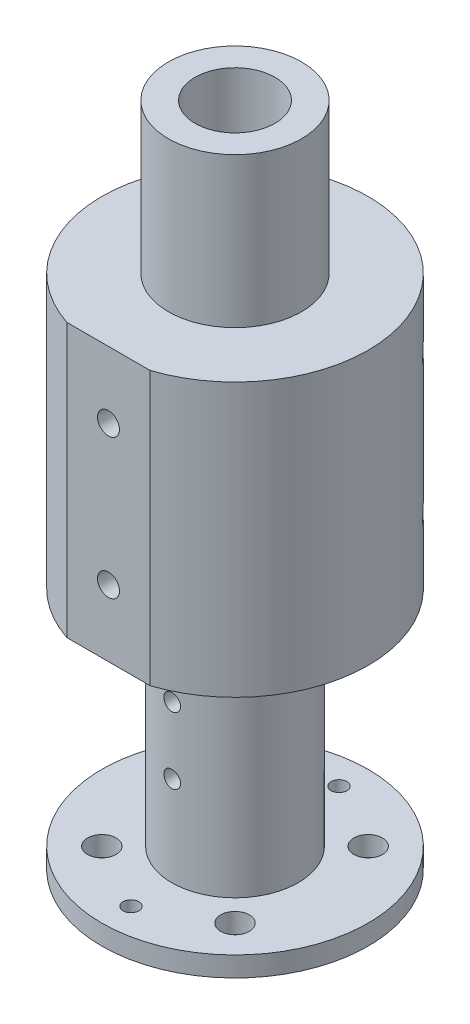
from build123d import *

# Parameters (mm, degrees)
CUT_EXTRUDE2_REACH              = 84.5
M4_TAPPED_HOLE1_D               = 3.3
M4_TAPPED_HOLE1_DEPTH           = 10.1
M4_TAPPED_HOLE1_TIP             = 0.991420021
M4_TAPPED_HOLE1_ON_FACE_2_D     = 3.3
M4_TAPPED_HOLE1_ON_FACE_2_DEPTH = 10.1
M4_TAPPED_HOLE1_ON_FACE_2_TIP   = 0.991420021
M4_TAPPED_HOLE1_ON_FACE_3_D     = 3.3
M4_TAPPED_HOLE1_ON_FACE_3_DEPTH = 10.1
M4_TAPPED_HOLE1_ON_FACE_3_TIP   = 0.991420021
M4_TAPPED_HOLE1_ON_FACE_4_D     = 3.3
M4_TAPPED_HOLE1_ON_FACE_4_DEPTH = 10.1
M4_TAPPED_HOLE1_ON_FACE_4_TIP   = 0.991420021
CUT_EXTRUDE1_START              = -66.9
CUT_EXTRUDE1_DEPTH              = 66.9
M3_TAPPED_HOLE1_REACH           = 92.788
M3_TAPPED_HOLE1_BORE_R          = 1.25
F_2_4MM_DOWEL_HOLE1_D           = 2.38125
F_2_4MM_DOWEL_HOLE1_DEPTH       = 3
M4_CLEARANCE_HOLE2_D            = 4.3
M4_CLEARANCE_HOLE2_DEPTH        = 3


with BuildPart() as part:
    # Sketch1 → Revolve1 (revolve)
    with BuildSketch(Plane.XY, mode=Mode.PRIVATE) as revolve1_sk:
        Polygon((5.5, 66.9), (5.5, 0), (20, 0), (20, 3), (9.5, 3), (9.5, 36.5), (20, 36.5), (20, 77.5), (10, 77.5), (10, 100), (6, 100), (6, 66.9), align=None)
    revolve(revolve1_sk.sketch.rotate(Axis((0, 0, 0), (0, 1, 0)), 90), axis=Axis((0, 0, 0), (0, 1, 0)))

    # Sketch6 → Cut-Extrude2 (cut, up to next)
    with BuildSketch(Plane(origin=(0, 77.5, 0), x_dir=(1, 0, 0), z_dir=(0, 1, 0)), mode=Mode.PRIVATE) as cut_extrude2_sk1:
        with BuildLine():
            Line((-6.244997998, -19), (6.244997998, -19))
            ThreePointArc((6.244997998, -19), (0, -20), (-6.244997998, -19))
        make_face()
    cut_extrude2_tool1 = extrude(cut_extrude2_sk1.sketch, amount=-CUT_EXTRUDE2_REACH, mode=Mode.PRIVATE) & part.part
    add(cut_extrude2_tool1.solids().sort_by_distance((0, 77.5, 19.40087))[0], mode=Mode.SUBTRACT)

    # M4 Tapped Hole1
    with Locations(Plane(origin=(14.142135624, 67.5, -14.142135624), x_dir=(0.707106781187, 0, 0.707106781187), z_dir=(0.707106781187, 0, -0.707106781187))):
        with Locations((0, 0)):
            Hole(M4_TAPPED_HOLE1_D / 2, depth=M4_TAPPED_HOLE1_DEPTH)
            with Locations((0, 0, -(M4_TAPPED_HOLE1_DEPTH + M4_TAPPED_HOLE1_TIP / 2))):  # 118° drill point
                Cone(0, M4_TAPPED_HOLE1_D / 2, M4_TAPPED_HOLE1_TIP, mode=Mode.SUBTRACT)

    # M4 Tapped Hole1 on face 2
    with Locations(Plane(origin=(14.142135624, 46.5, -14.142135624), x_dir=(-0.707106781187, 0, -0.707106781187), z_dir=(0.707106781187, 0, -0.707106781187))):
        with Locations((0, 0)):
            Hole(M4_TAPPED_HOLE1_ON_FACE_2_D / 2, depth=M4_TAPPED_HOLE1_ON_FACE_2_DEPTH)
            with Locations((0, 0, -(M4_TAPPED_HOLE1_ON_FACE_2_DEPTH + M4_TAPPED_HOLE1_ON_FACE_2_TIP / 2))):  # 118° drill point
                Cone(0, M4_TAPPED_HOLE1_ON_FACE_2_D / 2, M4_TAPPED_HOLE1_ON_FACE_2_TIP, mode=Mode.SUBTRACT)

    # M4 Tapped Hole1 on face 3
    with Locations(Plane(origin=(-14.142135624, 46.5, -14.142135624), x_dir=(-0.707106781187, 0, 0.707106781187), z_dir=(-0.707106781187, 0, -0.707106781187))):
        with Locations((0, 0), (0, 21)):
            Hole(M4_TAPPED_HOLE1_ON_FACE_3_D / 2, depth=M4_TAPPED_HOLE1_ON_FACE_3_DEPTH)
            with Locations((0, 0, -(M4_TAPPED_HOLE1_ON_FACE_3_DEPTH + M4_TAPPED_HOLE1_ON_FACE_3_TIP / 2))):  # 118° drill point
                Cone(0, M4_TAPPED_HOLE1_ON_FACE_3_D / 2, M4_TAPPED_HOLE1_ON_FACE_3_TIP, mode=Mode.SUBTRACT)

    # M4 Tapped Hole1 on face 4
    with Locations(Plane(origin=(0, 67.5, 19), x_dir=(1, 0, 0), z_dir=(0, 0, 1))):
        with Locations((0, 0), (0, -21)):
            Hole(M4_TAPPED_HOLE1_ON_FACE_4_D / 2, depth=M4_TAPPED_HOLE1_ON_FACE_4_DEPTH)
            with Locations((0, 0, -(M4_TAPPED_HOLE1_ON_FACE_4_DEPTH + M4_TAPPED_HOLE1_ON_FACE_4_TIP / 2))):  # 118° drill point
                Cone(0, M4_TAPPED_HOLE1_ON_FACE_4_D / 2, M4_TAPPED_HOLE1_ON_FACE_4_TIP, mode=Mode.SUBTRACT)

    # Sketch3 → Cut-Extrude1 (cut)
    with BuildSketch(Plane.XZ.offset(CUT_EXTRUDE1_START)):
        with BuildLine():
            ThreePointArc((4.818762467, -2.651325759), (0, -5.885414894), (-4.818762467, -2.651325759))
            ThreePointArc((-4.818762467, -2.651325759), (0, 5.612925106), (4.818762467, -2.651325759))
        make_face()
    extrude(amount=CUT_EXTRUDE1_DEPTH, mode=Mode.SUBTRACT)

    # M3 Tapped Hole1 bore (on position points) → M3 Tapped Hole1 (cut, up to next)
    with BuildSketch(Plane(origin=(0, 16.5, 9.5), x_dir=(1, 0, 0), z_dir=(0, 0, 1)), mode=Mode.PRIVATE) as m3_tapped_hole1_sk1:
        Circle(M3_TAPPED_HOLE1_BORE_R)
    m3_tapped_hole1_tool1 = extrude(m3_tapped_hole1_sk1.sketch, amount=-M3_TAPPED_HOLE1_REACH, mode=Mode.PRIVATE) & part.part
    # M3 Tapped Hole1 bore (on position points) → M3 Tapped Hole1 (cut, up to next)
    with BuildSketch(Plane(origin=(0, 16.5, 9.5), x_dir=(1, 0, 0), z_dir=(0, 0, 1)), mode=Mode.PRIVATE) as m3_tapped_hole1_sk2:
        with Locations((0, 10)):
            Circle(M3_TAPPED_HOLE1_BORE_R)
    m3_tapped_hole1_tool2 = extrude(m3_tapped_hole1_sk2.sketch, amount=-M3_TAPPED_HOLE1_REACH, mode=Mode.PRIVATE) & part.part
    add(m3_tapped_hole1_tool1.solids().sort_by_distance((0, 16.5, 9.5))[0], mode=Mode.SUBTRACT)
    add(m3_tapped_hole1_tool2.solids().sort_by_distance((0, 26.5, 9.5))[0], mode=Mode.SUBTRACT)

    # Ø2.4mm Dowel Hole1
    with Locations(Plane(origin=(0, 0, 0), x_dir=(-1, 0, 0), z_dir=(0, -1, 0))):
        with Locations((0, -15.621), (0, 15.621)):
            Hole(F_2_4MM_DOWEL_HOLE1_D / 2, depth=F_2_4MM_DOWEL_HOLE1_DEPTH)

    # M4 Clearance Hole2
    with Locations(Plane(origin=(0, 3, 0), x_dir=(1, 0, 0), z_dir=(0, 1, 0))):
        with Locations((-10, -10), (0, 0), (-10, 10), (10, 10), (10, -10)):
            Hole(M4_CLEARANCE_HOLE2_D / 2, depth=M4_CLEARANCE_HOLE2_DEPTH)


solid = part.part
